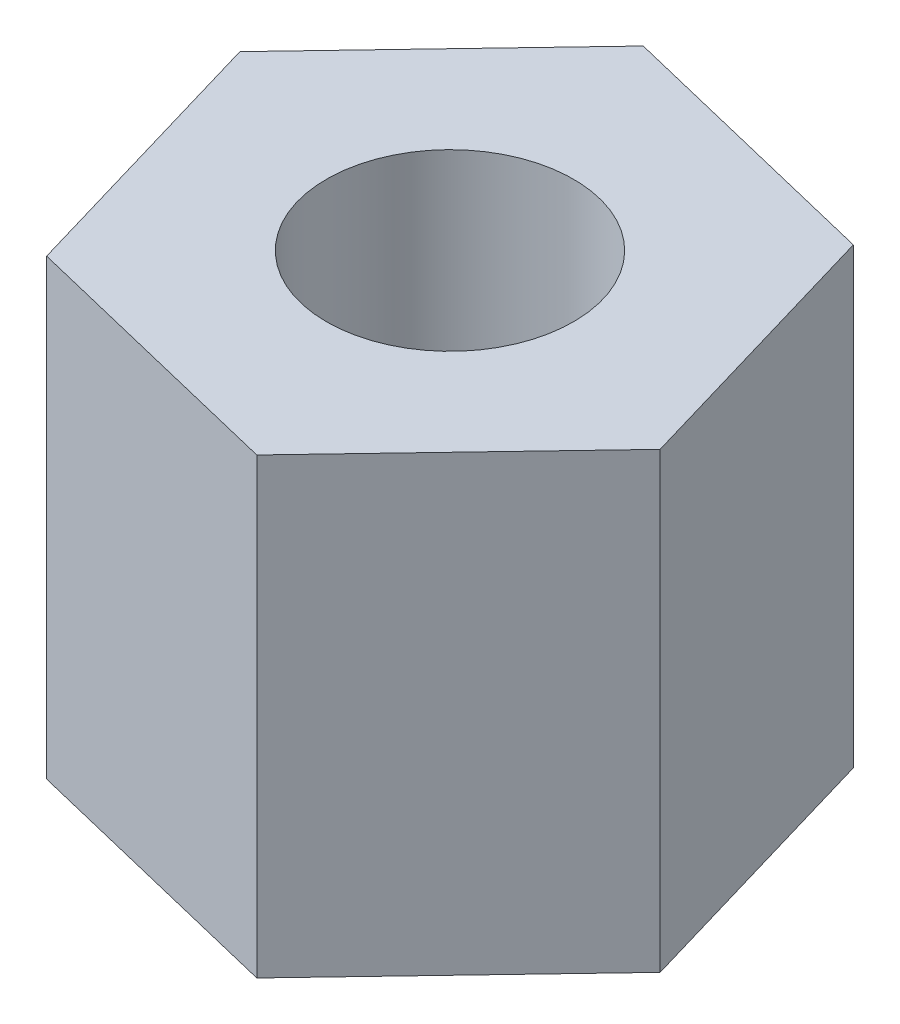
from build123d import *

# Parameters (mm, degrees)
SKETCH1_R           = 1.5
BOSS_EXTRUDE1_DEPTH = 2.75


with BuildPart() as part:
    # Sketch1 → Boss-Extrude1 (new, symmetric)
    with BuildSketch(Plane(origin=(0, 0, 0), x_dir=(1, 0, 0), z_dir=(0, 1, 0))):
        Polygon((0.977287067, -3.32338833), (3.366782253, -0.815338738), (2.389495187, 2.508049591), (-0.977287067, 3.32338833), (-3.366782253, 0.815338738), (-2.389495187, -2.508049591), align=None)
        with Locations(Location((0, 0, 0), (0, 0, 270))):
            Circle(SKETCH1_R, mode=Mode.SUBTRACT)
    extrude(amount=BOSS_EXTRUDE1_DEPTH, both=True)


solid = part.part
